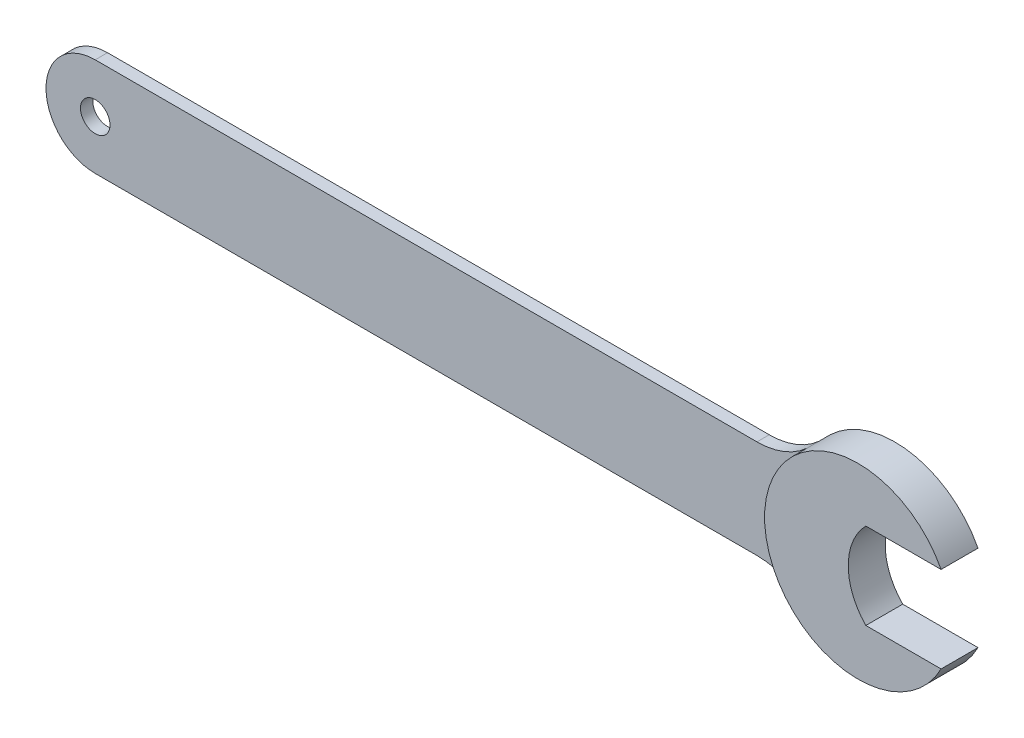
from build123d import *

# Parameters (mm, degrees)
SKETCH1_R           = 6
BOSS_EXTRUDE1_DEPTH = 2.5
BOSS_EXTRUDE2_DEPTH = 7.5


with BuildPart() as part:
    # Sketch1 → Boss-Extrude1 (new, symmetric)
    with BuildSketch(Plane.XY):
        with BuildLine():
            Line((268.913125513, 20), (0, 20))
            ThreePointArc((0, 20), (-20, 0), (0, -20))
            Line((0, -20), (268.913125513, -20))
            ThreePointArc((268.913125513, -20), (279.827228639, -22.055727726), (289.245570139, -27.941176471))
            ThreePointArc((289.245570139, -27.941176471), (277, 0), (289.245570139, 27.941176471))
            ThreePointArc((289.245570139, 27.941176471), (279.827228639, 22.055727726), (268.913125513, 20))
        make_face()
        Circle(SKETCH1_R, mode=Mode.SUBTRACT)
    extrude(amount=BOSS_EXTRUDE1_DEPTH, both=True)

    # Sketch1<4> → Boss-Extrude2 (add, symmetric)
    with BuildSketch(Plane.XY):
        with BuildLine():
            ThreePointArc((348.730549951, 17.5), (321.56956349, 37.427808319), (289.245570139, 27.941176471))
            ThreePointArc((289.245570139, 27.941176471), (277, 0), (289.245570139, -27.941176471))
            ThreePointArc((289.245570139, -27.941176471), (321.56956349, -37.427808319), (348.730549951, -17.5))
            Line((348.730549951, -17.5), (318.146428929, -17.5))
            ThreePointArc((318.146428929, -17.5), (312.855462018, -9.451474044), (311, 0))
            ThreePointArc((311, 0), (312.855462018, 9.451474044), (318.146428929, 17.5))
            Line((318.146428929, 17.5), (348.730549951, 17.5))
        make_face()
    extrude(amount=BOSS_EXTRUDE2_DEPTH, both=True)


solid = part.part
